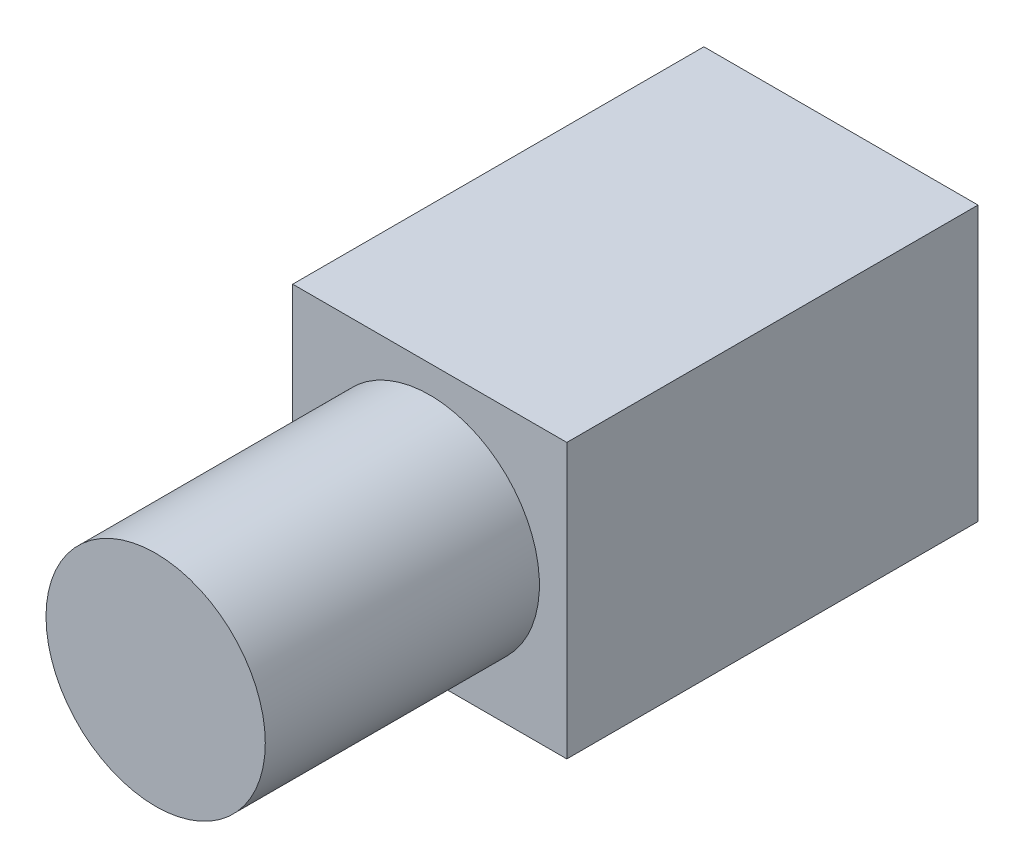
from build123d import *

# Parameters (mm, degrees)
SKETCH_3_W      = 10
SKETCH_3_H      = 10
EXTRUDE_3_DEPTH = 15
SKETCH_4_R      = 4
EXTRUDE_4_DEPTH = 10


with BuildPart() as part:
    # ｽｹｯﾁ3 → ﾎﾞｽ - 押し出し3 (new body)
    with BuildSketch(Plane.XY):
        with Locations((5, 5)):
            Rectangle(SKETCH_3_W, SKETCH_3_H)
    extrude(amount=EXTRUDE_3_DEPTH)

    # ｽｹｯﾁ4 → ﾎﾞｽ - 押し出し4 (add)
    with BuildSketch(Plane.XY.offset(15)):
        with Locations(Location((5, 5, 0), (0, 0, 180))):
            Circle(SKETCH_4_R)
    extrude(amount=EXTRUDE_4_DEPTH)


solid = part.part
